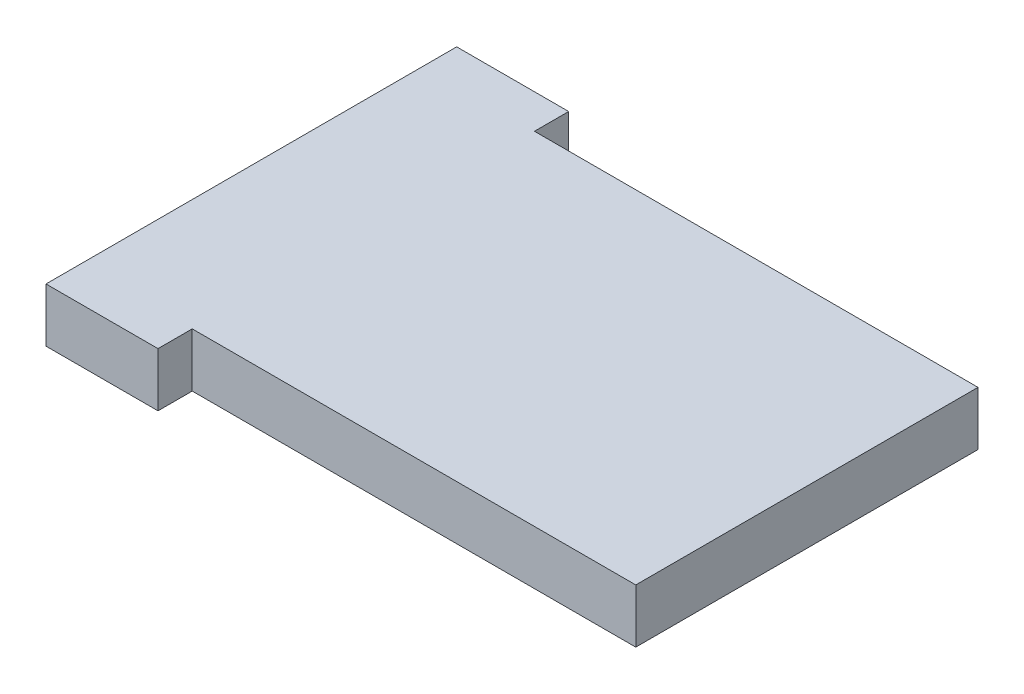
from build123d import *

# Parameters (mm, degrees)
BOSS_EXTRUDE1_DEPTH = 5


with BuildPart() as part:
    # Sketch1 → Boss-Extrude1 (new body)
    with BuildSketch(Plane(origin=(0, 0, 0), x_dir=(1, 0, 0), z_dir=(0, 1, 0))):
        Polygon((0, 19.05), (0, -19.05), (10.391066581, -19.05), (10.391066581, -15.875), (51.538586848, -15.875), (51.538586848, 15.875), (10.391066581, 15.875), (10.391066581, 19.05), align=None)
    extrude(amount=BOSS_EXTRUDE1_DEPTH)


solid = part.part
